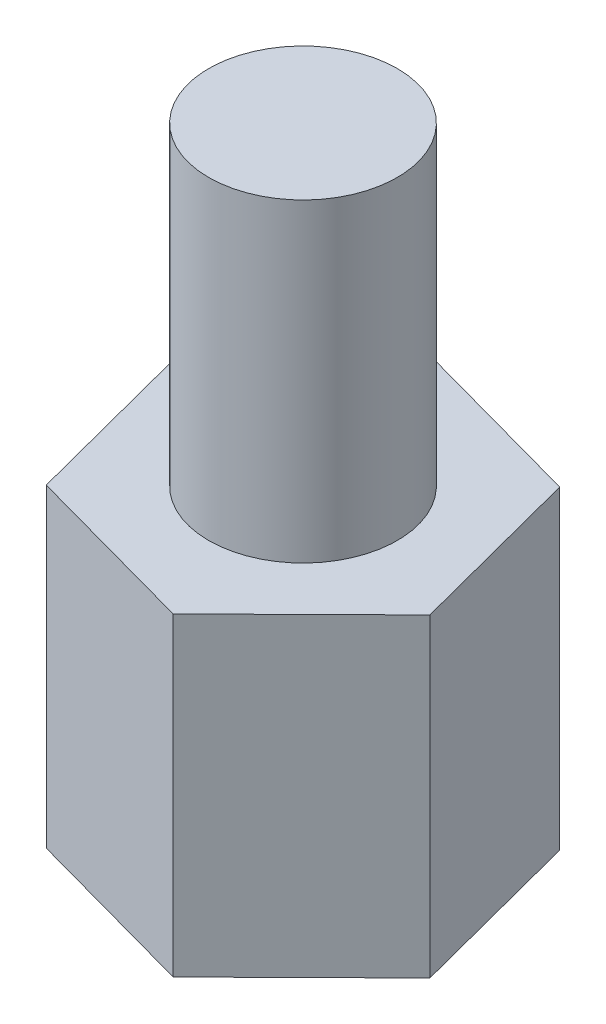
from build123d import *

# Parameters (mm, degrees)
EXTRUDE_1_DEPTH     = 5
SKETCH_2_R          = 1.5
EXTRUDE_2_DEPTH     = 5
SKETCH_3_R          = 1.5
CUT_EXTRUDE_1_DEPTH = 5


with BuildPart() as part:
    # 草图1 → 凸台-拉伸1 (new body)
    with BuildSketch(Plane(origin=(0, 0, 0), x_dir=(1, 0, 0), z_dir=(0, 1, 0))):
        Polygon((0.728679251, -2.793270463), (2.783382807, -0.765580489), (2.054703555, 2.027689975), (-0.728679251, 2.793270463), (-2.783382807, 0.765580489), (-2.054703555, -2.027689975), align=None)
    extrude(amount=EXTRUDE_1_DEPTH)

    # 草图2 → 凸台-拉伸2 (add)
    with BuildSketch(Plane(origin=(0, 5, 0), x_dir=(1, 0, 0), z_dir=(0, 1, 0))):
        with Locations(Location((0, 0, 0), (0, 0, 270))):
            Circle(SKETCH_2_R)
    extrude(amount=EXTRUDE_2_DEPTH)

    # 草图3 → 切除-拉伸1 (cut)
    with BuildSketch(Plane.XZ):
        with Locations(Location((0, 0, 0), (0, 0, 270))):
            Circle(SKETCH_3_R)
    extrude(amount=-CUT_EXTRUDE_1_DEPTH, mode=Mode.SUBTRACT)


with BuildPart() as cut_extrude_1_piece_1:
    # of the separate pieces the step leaves, piece 1, a body of its own (cut_extrude_1_pieces)
    add(part.part.solids().sort_by_distance((0.728679251, 0, 2.793270463))[0])


with BuildPart() as cut_extrude_1_piece_2:
    # of the separate pieces the step leaves, piece 2, a body of its own (cut_extrude_1_pieces)
    add(part.part.solids().sort_by_distance((0, 10, 1.5))[0])


solid = Compound([cut_extrude_1_piece_1.part, cut_extrude_1_piece_2.part])
